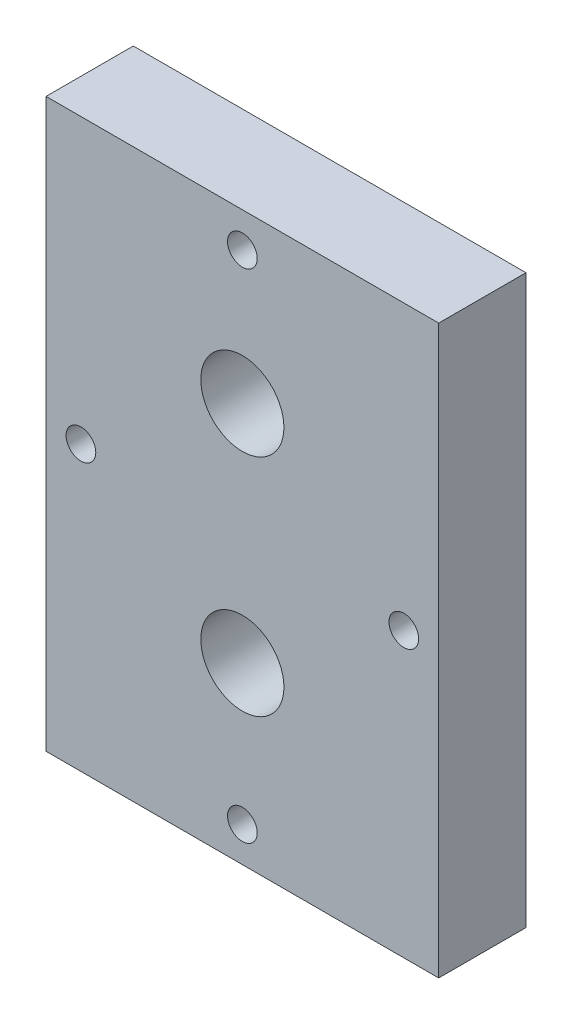
from build123d import *

# Parameters (mm, degrees)
ESBO_O2_W                = 45
ESBO_O2_H                = 65
RESSALTO_EXTRUS_O2_DEPTH = 10
ESBO_O3_R                = 4.7625
CORTE_EXTRUS_O1_DEPTH    = 162.549920911
FURO_COM_FOLGA_DE_M31_D  = 3.4
ESBO_O6_R                = 3.75
CORTE_EXTRUS_O2_DEPTH    = 2.45


with BuildPart() as part:
    # Esboço2 → Ressalto-extrusão2 (new body)
    with BuildSketch(Plane.XY):
        with Locations((-19.282851211, 123.232367513)):
            Rectangle(ESBO_O2_W, ESBO_O2_H)
    extrude(amount=-RESSALTO_EXTRUS_O2_DEPTH)

    # Esboço3 → Corte-extrusão1 (cut, through all)
    with BuildSketch(Plane.XY):
        with Locations((-19.282851211, 136.502367513)):
            Circle(ESBO_O3_R)
        with Locations((-19.282851211, 110.732367513)):
            Circle(ESBO_O3_R)
    extrude(amount=-CORTE_EXTRUS_O1_DEPTH, mode=Mode.SUBTRACT)

    # Furo com folga de M31 (through all)
    with Locations(Plane(origin=(0.160463456, 1.173491391, -10), x_dir=(-1, 0, 0), z_dir=(0, 0, -1))):
        with Locations((19.443314667, 93.558876122), (19.443314667, 150.558876122), (0.943314667, 122.058876122), (37.943314667, 122.058876122)):
            Hole(FURO_COM_FOLGA_DE_M31_D / 2)

    # Esboço6 → Corte-extrusão2 (cut)
    with BuildSketch(Plane(origin=(0, 0, -10), x_dir=(-1, 0, 0), z_dir=(0, 0, -1))):
        with Locations((0.782851211, 123.232367513)):
            Circle(ESBO_O6_R)
    extrude(amount=-CORTE_EXTRUS_O2_DEPTH, mode=Mode.SUBTRACT)


solid = part.part
